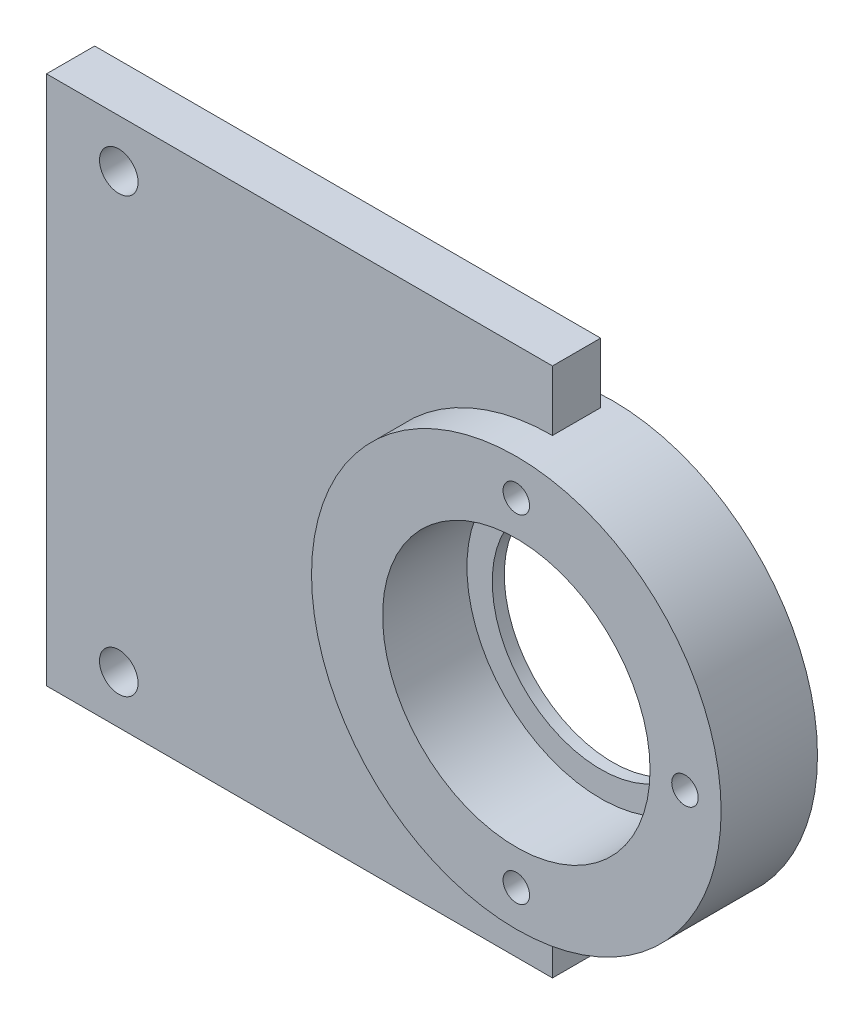
from build123d import *

# Parameters (mm, degrees)
BEARING_HOUSING_PROFILE_R                  = 17
BEARING_HOUSING_PROFILE_R_2                = 11.1
BEARING_HOUSING_DEPTH                      = 7
MOUNTING_WEB_PROFILE_W                     = 42
MOUNTING_WEB_PROFILE_H                     = 44
MOUNTING_WEB_DEPTH                         = 4
BEARING_SEAT_START                         = -50
BEARING_SEAT_PROFILE_R                     = 11.1
BEARING_SEAT_DEPTH                         = 98.927027865
INNER_OUTER_RACE_RETAINING_LIP_START       = -1
INNER_OUTER_RACE_RETAINING_LIP_PROFILE_R   = 17
INNER_OUTER_RACE_RETAINING_LIP_PROFILE_R_2 = 9
INNER_OUTER_RACE_RETAINING_LIP_DEPTH       = 1
STANDOFF_FASTENERS_START                   = -50
STANDOFF_FASTENERS_PROFILE_R               = 1.6
STANDOFF_FASTENERS_DEPTH                   = 98.927027865
BEARING_KEEPER_FASTENERS_START             = -50
BEARING_KEEPER_FASTENERS_PROFILE_R         = 1.1
BEARING_KEEPER_FASTENERS_DEPTH             = 98.927027865


with BuildPart() as part:
    # Bearing_housing_profile → Bearing_housing (new body)
    with BuildSketch(Plane.XY):
        Circle(BEARING_HOUSING_PROFILE_R)
        Circle(BEARING_HOUSING_PROFILE_R_2, mode=Mode.SUBTRACT)
    extrude(amount=BEARING_HOUSING_DEPTH)

    # Mounting_web_profile → Mounting_web (add)
    with BuildSketch(Plane.XY):
        with Locations((-21, 0)):
            Rectangle(MOUNTING_WEB_PROFILE_W, MOUNTING_WEB_PROFILE_H)
    extrude(amount=MOUNTING_WEB_DEPTH)

    # Bearing_seat_profile → Bearing_seat (cut, through all)
    with BuildSketch(Plane.XY.offset(BEARING_SEAT_START)):
        Circle(BEARING_SEAT_PROFILE_R)
    extrude(amount=BEARING_SEAT_DEPTH, mode=Mode.SUBTRACT)

    # Inner_outer_race_retaining_lip_profile → Inner_outer_race_retaining_lip (add)
    with BuildSketch(Plane.XY.offset(INNER_OUTER_RACE_RETAINING_LIP_START)):
        Circle(INNER_OUTER_RACE_RETAINING_LIP_PROFILE_R)
        Circle(INNER_OUTER_RACE_RETAINING_LIP_PROFILE_R_2, mode=Mode.SUBTRACT)
    extrude(amount=INNER_OUTER_RACE_RETAINING_LIP_DEPTH)

    # Standoff_fasteners_profile → Standoff_fasteners (cut, through all)
    with BuildSketch(Plane.XY.offset(STANDOFF_FASTENERS_START)):
        with Locations(Location((-36, -18, 0), (0, 0, 180))):
            Circle(STANDOFF_FASTENERS_PROFILE_R)
        with Locations(Location((-36, 18, 0), (0, 0, 180))):
            Circle(STANDOFF_FASTENERS_PROFILE_R)
    extrude(amount=STANDOFF_FASTENERS_DEPTH, mode=Mode.SUBTRACT)

    # Bearing_keeper_fasteners_profile → Bearing_keeper_fasteners (cut, through all)
    with BuildSketch(Plane.XY.offset(BEARING_KEEPER_FASTENERS_START)):
        with Locations(Location((14, 0, 0), (0, 0, 180))):
            Circle(BEARING_KEEPER_FASTENERS_PROFILE_R)
        with Locations(Location((0, -14, 0), (0, 0, 180))):
            Circle(BEARING_KEEPER_FASTENERS_PROFILE_R)
        with Locations(Location((0, 14, 0), (0, 0, 180))):
            Circle(BEARING_KEEPER_FASTENERS_PROFILE_R)
    extrude(amount=BEARING_KEEPER_FASTENERS_DEPTH, mode=Mode.SUBTRACT)


solid = part.part
